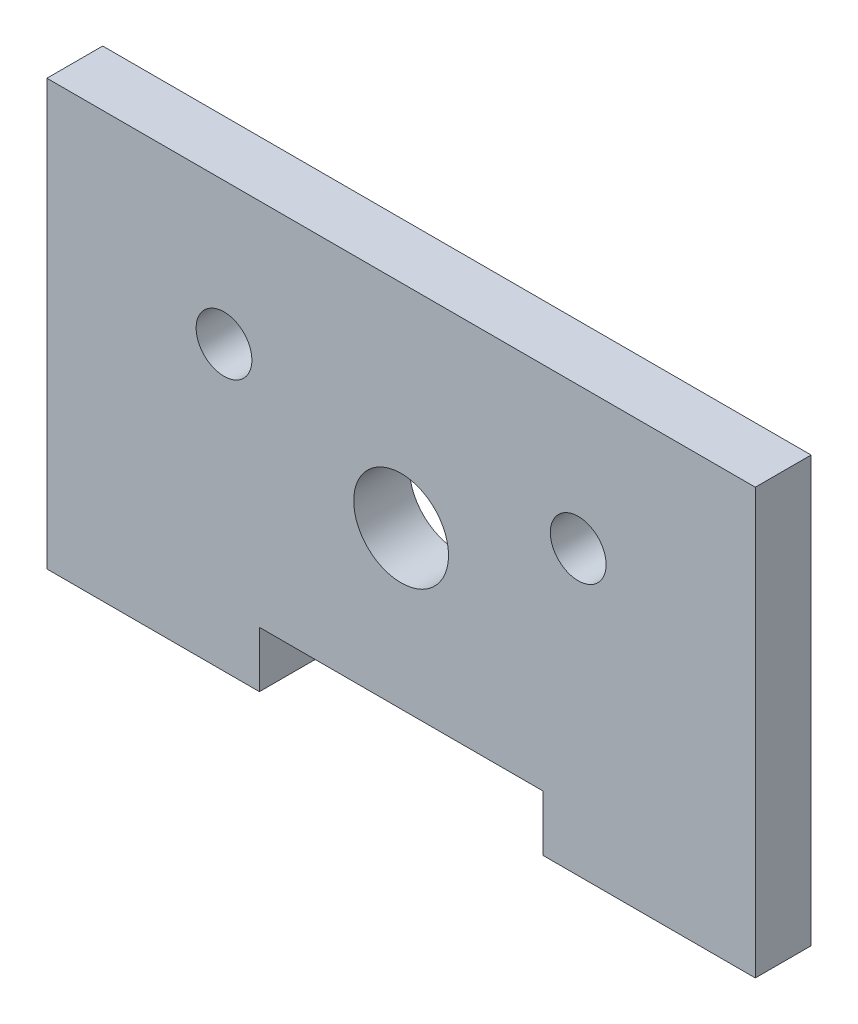
from build123d import *

# Parameters (mm, degrees)
SKETCH1_R           = 8.5
SKETCH1_R_2         = 5
BOSS_EXTRUDE1_DEPTH = 10


with BuildPart() as part:
    # Sketch1 → Boss-Extrude1 (new body)
    with BuildSketch(Plane.XY):
        Polygon((-63.5, -38.1), (-25.4, -38.1), (-25.4, -28.1), (25.4, -28.1), (25.4, -38.1), (63.5, -38.1), (63.5, 38.1), (-63.5, 38.1), align=None)
        Circle(SKETCH1_R, mode=Mode.SUBTRACT)
        with Locations((-31.75, 12.7)):
            Circle(SKETCH1_R_2, mode=Mode.SUBTRACT)
        with Locations((31.75, 12.7)):
            Circle(SKETCH1_R_2, mode=Mode.SUBTRACT)
    extrude(amount=BOSS_EXTRUDE1_DEPTH)


solid = part.part
